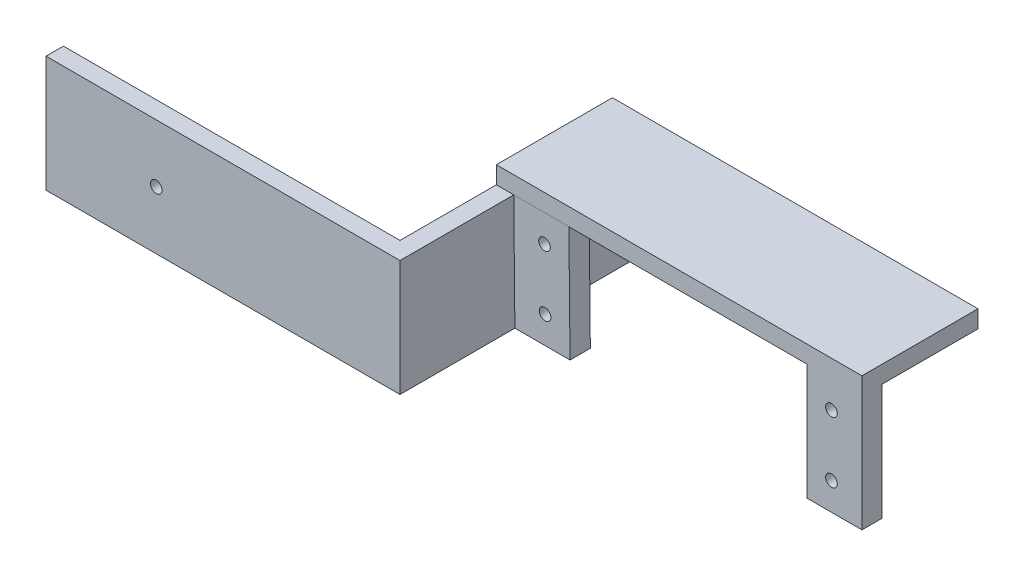
from build123d import *

# Parameters (mm, degrees)
SALIENTE_EXTRUIR1_DEPTH = 20
CROQUIS2_W              = 3
CROQUIS2_H              = 20
SALIENTE_EXTRUIR2_DEPTH = 3
CROQUIS3_W              = 20
CROQUIS3_H              = 3
SALIENTE_EXTRUIR3_DEPTH = 60
SALIENTE_EXTRUIR4_DEPTH = 9.5
CROQUIS5_W              = 9.5
CROQUIS5_H              = 3.5
SALIENTE_EXTRUIR6_DEPTH = 20
CROQUIS6_R              = 4
CORTAR_EXTRUIR1_DEPTH   = 1.2
CROQUIS7_R              = 1
CORTAR_EXTRUIR2_DEPTH   = 1.8
CROQUIS8_R              = 1
CORTAR_EXTRUIR4_DEPTH   = 6.75


with BuildPart() as part:
    # Croquis1 → Saliente-Extruir1 (new body)
    with BuildSketch(Plane(origin=(0, 0, 0), x_dir=(1, 0, 0), z_dir=(0, 1, 0))):
        Polygon((-63.528635851, -28.815731451), (-2.528635851, -28.815731451), (-2.528635851, 10.784268549), (-5.528635851, 10.784268549), (-5.528635851, -25.815731451), (-63.528635851, -25.815731451), align=None)
    extrude(amount=SALIENTE_EXTRUIR1_DEPTH)

    # Croquis2 → Saliente-Extruir2 (add)
    with BuildSketch(Plane(origin=(0, 20, 0), x_dir=(1, 0, 0), z_dir=(0, 1, 0))):
        with Locations((-4.028635851, 0.784268549)):
            Rectangle(CROQUIS2_W, CROQUIS2_H)
    extrude(amount=SALIENTE_EXTRUIR2_DEPTH)

    # Croquis3 → Saliente-Extruir3 (add)
    with BuildSketch(Plane(origin=(-2.528635851, 0, 0), x_dir=(0, 0, -1), z_dir=(1, 0, 0))):
        with Locations((0.784268549, 21.5)):
            Rectangle(CROQUIS3_W, CROQUIS3_H)
    extrude(amount=SALIENTE_EXTRUIR3_DEPTH)

    # Croquis4 → Saliente-Extruir4 (add)
    with BuildSketch(Plane(origin=(-2.528635851, 0, 0), x_dir=(0, 0, -1), z_dir=(1, 0, 0))):
        Polygon((-9.215731451, 20), (-9.015731451, 0), (-5.515731451, 0), (-5.715731451, 20), align=None)
    extrude(amount=SALIENTE_EXTRUIR4_DEPTH)

    # Croquis5 → Saliente-Extruir6 (add)
    with BuildSketch(Plane.XZ.offset(-20)):
        with Locations((52.721364149, 7.465731451)):
            Rectangle(CROQUIS5_W, CROQUIS5_H)
    extrude(amount=SALIENTE_EXTRUIR6_DEPTH)

    # Croquis6 → Cortar-Extruir1 (cut)
    with BuildSketch(Plane(origin=(0, 0, 25.815731451), x_dir=(-1, 0, 0), z_dir=(0, 0, -1))):
        with Locations((44.528635851, 10)):
            Circle(CROQUIS6_R)
    extrude(amount=-CORTAR_EXTRUIR1_DEPTH, mode=Mode.SUBTRACT)

    # Croquis7 → Cortar-Extruir2 (cut)
    with BuildSketch(Plane(origin=(0, 0, 27.015731451), x_dir=(-1, 0, 0), z_dir=(0, 0, -1))):
        with Locations((44.528635851, 10)):
            Circle(CROQUIS7_R)
    extrude(amount=-CORTAR_EXTRUIR2_DEPTH, mode=Mode.SUBTRACT)

    # Croquis8 → Cortar-Extruir4 (cut, symmetric)
    with BuildSketch(Plane(origin=(0, -0.0901483, 9.014829968), x_dir=(1, 0, 0), z_dir=(0, -0.009999500037496644, 0.9999500037496877))):
        with Locations(Location((2.721364149, 15.340652794, 0), (0, 0, 270))):
            Circle(CROQUIS8_R)
        with Locations(Location((2.721364149, 4.840152807, 0), (0, 0, 270))):
            Circle(CROQUIS8_R)
        with Locations(Location((52.221364149, 15.340652794, 0), (0, 0, 270))):
            Circle(CROQUIS8_R)
        with Locations(Location((52.221364149, 4.840152807, 0), (0, 0, 270))):
            Circle(CROQUIS8_R)
    extrude(amount=CORTAR_EXTRUIR4_DEPTH, both=True, mode=Mode.SUBTRACT)


solid = part.part
